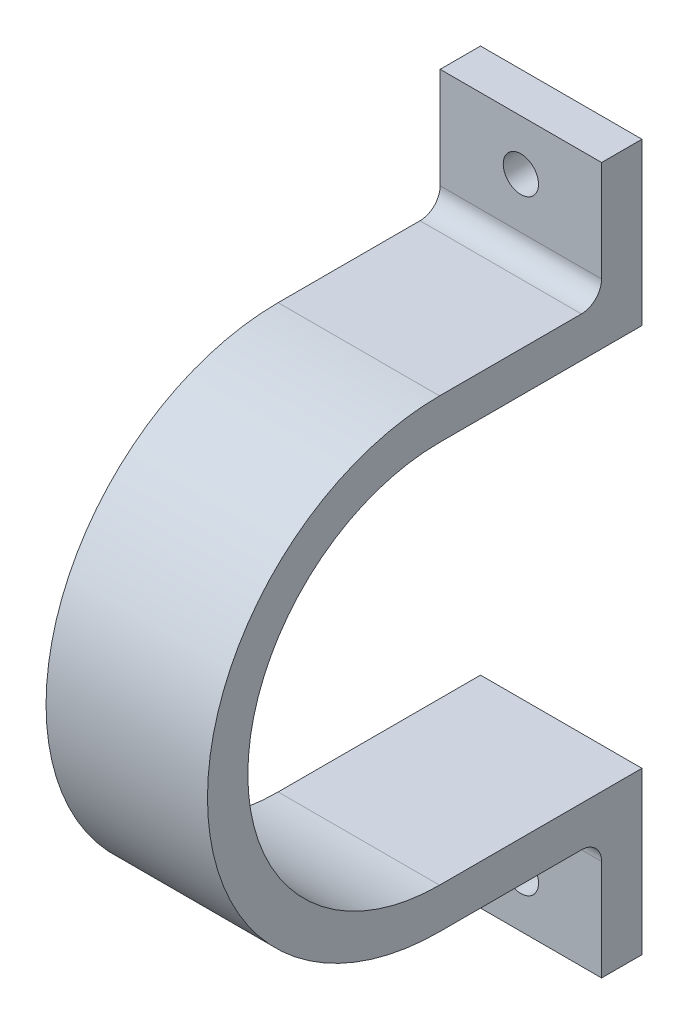
from build123d import *

# Parameters (mm, degrees)
BOSS_EXTRUDE1_DEPTH = 16
CUT_EXTRUDE1_REACH  = 72.897
SKETCH3_R           = 1.75
FILLET1_R           = 2


with BuildPart() as part:
    # Sketch2 → Boss-Extrude1 (new body)
    with BuildSketch(Plane.YZ):
        with BuildLine():
            Line((0, 0), (0, 20.06238879))
            ThreePointArc((0, 20.06238879), (-19, 39.06238879), (-38, 20.06238879))
            Line((-38, 20.06238879), (-38, 0))
            Line((-38, 0), (-54, 0))
            Line((-54, 0), (-54, 4))
            Line((-54, 4), (-42, 4))
            Line((-42, 4), (-42, 20.06238879))
            ThreePointArc((-42, 20.06238879), (-19, 43.06238879), (4, 20.06238879))
            Line((4, 20.06238879), (4, 4))
            Line((4, 4), (16, 4))
            Line((16, 4), (16, 0))
            Line((16, 0), (0, 0))
        make_face()
    extrude(amount=BOSS_EXTRUDE1_DEPTH)

    # Sketch3 → Cut-Extrude1 (cut, up to next)
    with BuildSketch(Plane(origin=(0, 0, 0), x_dir=(1, 0, 0), z_dir=(0, 0, -1)), mode=Mode.PRIVATE) as cut_extrude1_sk1:
        with Locations(Location((8, 49, 0), (0, 0, 270))):
            Circle(SKETCH3_R)
    cut_extrude1_tool1 = extrude(cut_extrude1_sk1.sketch, amount=-CUT_EXTRUDE1_REACH, mode=Mode.PRIVATE) & part.part
    # Sketch3 → Cut-Extrude1 (cut, up to next)
    with BuildSketch(Plane(origin=(0, 0, 0), x_dir=(1, 0, 0), z_dir=(0, 0, -1)), mode=Mode.PRIVATE) as cut_extrude1_sk2:
        with Locations(Location((8, -11, 0), (0, 0, 270))):
            Circle(SKETCH3_R)
    cut_extrude1_tool2 = extrude(cut_extrude1_sk2.sketch, amount=-CUT_EXTRUDE1_REACH, mode=Mode.PRIVATE) & part.part
    add(cut_extrude1_tool1.solids().sort_by_distance((8, -49, 0))[0], mode=Mode.SUBTRACT)
    add(cut_extrude1_tool2.solids().sort_by_distance((8, 11, 0))[0], mode=Mode.SUBTRACT)

    # Fillet1
    fillet1_edges = [part.edges().sort_by_distance(p)[0] for p in [
        (8, -42, 4),
        (8, 4, 4),
    ]]
    fillet(fillet1_edges, radius=FILLET1_R)


solid = part.part
